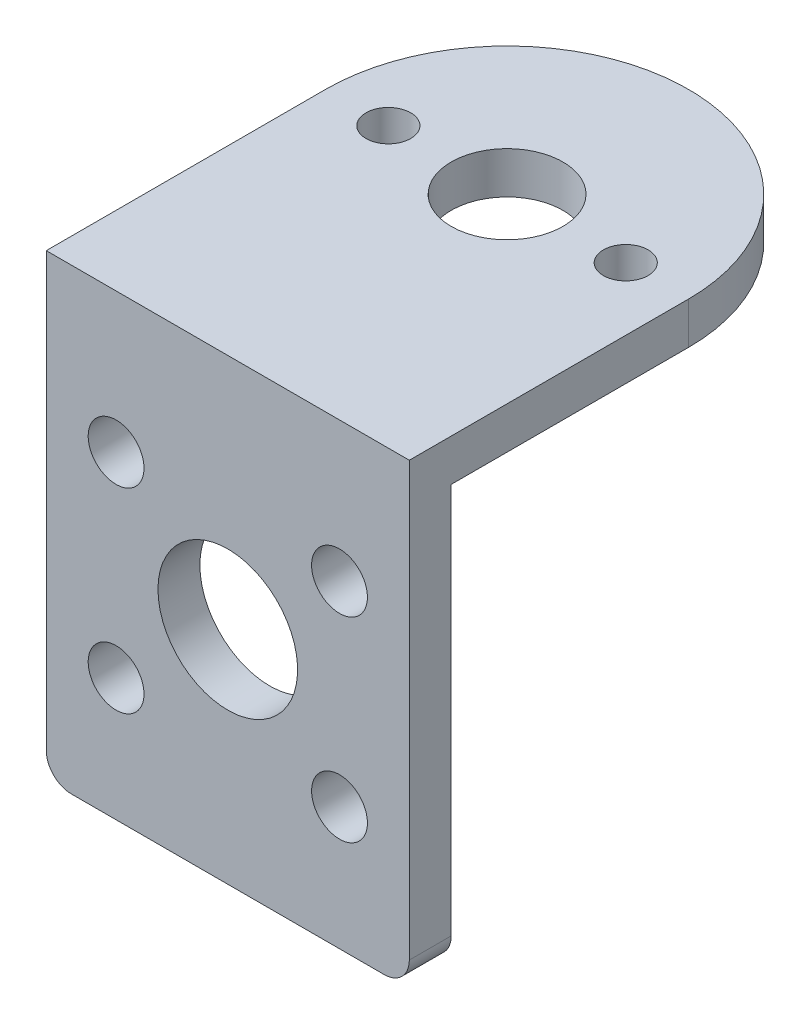
from build123d import *

# Parameters (mm, degrees)
SKETCH_1_R          = 1.6
SKETCH_1_R_2        = 4
EXTRUDE_1_DEPTH     = 3
SKETCH_2_W          = 26
SKETCH_2_H          = 3
EXTRUDE_2_DEPTH     = 28
SKETCH_3_R          = 5
SKETCH_3_R_2        = 2
CUT_EXTRUDE_1_DEPTH = 44.0464865
EXTRUDE_3_DEPTH     = 3


with BuildPart() as part:
    # 草图1 → 凸台-拉伸1 (new body)
    with BuildSketch(Plane(origin=(0, 0, 0), x_dir=(1, 0, 0), z_dir=(0, 1, 0))):
        with BuildLine():
            ThreePointArc((13, 0), (0, 13), (-13, 0))
            Line((-13, 0), (-13, -20))
            Line((-13, -20), (13, -20))
            Line((13, -20), (13, 0))
        make_face()
        with Locations((8.5, 0)):
            Circle(SKETCH_1_R, mode=Mode.SUBTRACT)
        with Locations((-8.5, 0)):
            Circle(SKETCH_1_R, mode=Mode.SUBTRACT)
        Circle(SKETCH_1_R_2, mode=Mode.SUBTRACT)
    extrude(amount=EXTRUDE_1_DEPTH)

    # 草图2 → 凸台-拉伸2 (add)
    with BuildSketch(Plane.XZ):
        with Locations((0, 18.5)):
            Rectangle(SKETCH_2_W, SKETCH_2_H)
    extrude(amount=EXTRUDE_2_DEPTH)

    # 草图3 → 切除-拉伸1 (cut, through all)
    with BuildSketch(Plane(origin=(0, 0, 17), x_dir=(-1, 0, 0), z_dir=(0, 0, -1))):
        with Locations((0, -14)):
            Circle(SKETCH_3_R)
        with Locations((8, -7)):
            Circle(SKETCH_3_R_2)
        with Locations((8, -21)):
            Circle(SKETCH_3_R_2)
        with Locations((-8, -21)):
            Circle(SKETCH_3_R_2)
        with Locations((-8, -7)):
            Circle(SKETCH_3_R_2)
    extrude(amount=-CUT_EXTRUDE_1_DEPTH, mode=Mode.SUBTRACT)

    # 草图3<4> → 凸台-拉伸3 (add)
    with BuildSketch(Plane(origin=(0, 0, 17), x_dir=(-1, 0, 0), z_dir=(0, 0, -1))):
        with BuildLine():
            Line((13, -28), (-13, -28))
            ThreePointArc((-13, -28), (-12.472792206, -29.272792206), (-11.2, -29.8))
            Line((-11.2, -29.8), (11.2, -29.8))
            ThreePointArc((11.2, -29.8), (12.472792206, -29.272792206), (13, -28))
        make_face()
    extrude(amount=-EXTRUDE_3_DEPTH)


solid = part.part
